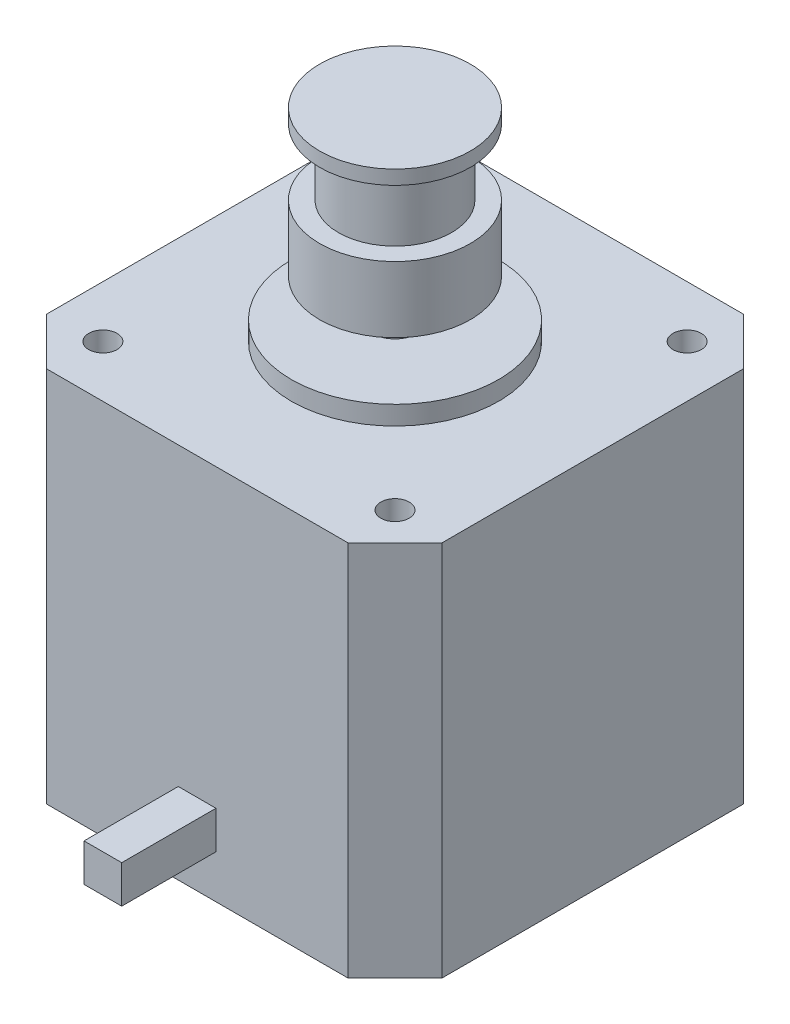
from build123d import *

# Parameters (mm, degrees)
SKETCH1_W           = 42
SKETCH1_H           = 42
BOSS_EXTRUDE1_DEPTH = 40
CHAMFER1_SIZE       = 5
SKETCH2_R           = 11
BOSS_EXTRUDE3_DEPTH = 2
SKETCH5_R           = 2.5
BOSS_EXTRUDE4_DEPTH = 4
SKETCH6_R           = 8
BOSS_EXTRUDE5_DEPTH = 7
SKETCH7_R           = 6
BOSS_EXTRUDE6_DEPTH = 7
SKETCH8_R           = 8
BOSS_EXTRUDE7_DEPTH = 1.5
SKETCH9_R           = 1.5
CUT_EXTRUDE1_DEPTH  = 4.5
SKETCH10_W          = 4
SKETCH10_H          = 4
BOSS_EXTRUDE8_DEPTH = 10


with BuildPart() as part:
    # Sketch1 → Boss-Extrude1 (new body)
    with BuildSketch(Plane(origin=(0, 0, 0), x_dir=(1, 0, 0), z_dir=(0, 1, 0))):
        Rectangle(SKETCH1_W, SKETCH1_H)
    extrude(amount=BOSS_EXTRUDE1_DEPTH)

    # Chamfer1
    chamfer1_edges = [part.edges().sort_by_distance(p)[0] for p in [
        (21, 20, 21),
        (-21, 20, 21),
        (-21, 20, -21),
        (21, 20, -21),
    ]]
    chamfer(chamfer1_edges, length=CHAMFER1_SIZE)

    # Sketch2 → Boss-Extrude3 (add)
    with BuildSketch(Plane(origin=(0, 40, 0), x_dir=(1, 0, 0), z_dir=(0, 1, 0))):
        with Locations(Location((0, 0, 0), (0, 0, 270))):
            Circle(SKETCH2_R)
    extrude(amount=BOSS_EXTRUDE3_DEPTH)

    # Sketch5 → Boss-Extrude4 (add)
    with BuildSketch(Plane(origin=(0, 42, 0), x_dir=(1, 0, 0), z_dir=(0, 1, 0))):
        with Locations(Location((0, 0, 0), (0, 0, 270))):
            Circle(SKETCH5_R)
    extrude(amount=BOSS_EXTRUDE4_DEPTH)

    # Sketch6 → Boss-Extrude5 (add)
    with BuildSketch(Plane(origin=(0, 46, 0), x_dir=(1, 0, 0), z_dir=(0, 1, 0))):
        with Locations(Location((0, 0, 0), (0, 0, 270))):
            Circle(SKETCH6_R)
    extrude(amount=BOSS_EXTRUDE5_DEPTH)

    # Sketch7 → Boss-Extrude6 (add)
    with BuildSketch(Plane(origin=(0, 53, 0), x_dir=(1, 0, 0), z_dir=(0, 1, 0))):
        with Locations(Location((0, 0, 0), (0, 0, 270))):
            Circle(SKETCH7_R)
    extrude(amount=BOSS_EXTRUDE6_DEPTH)

    # Sketch8 → Boss-Extrude7 (add)
    with BuildSketch(Plane(origin=(0, 60, 0), x_dir=(1, 0, 0), z_dir=(0, 1, 0))):
        with Locations(Location((0, 0, 0), (0, 0, 270))):
            Circle(SKETCH8_R)
    extrude(amount=BOSS_EXTRUDE7_DEPTH)

    # Sketch9 → Cut-Extrude1 (cut)
    with BuildSketch(Plane(origin=(0, 40, 0), x_dir=(1, 0, 0), z_dir=(0, 1, 0))):
        with Locations(Location((-15.5, 15.5, 0), (0, 0, 270))):
            Circle(SKETCH9_R)
        with Locations(Location((15.5, 15.5, 0), (0, 0, 270))):
            Circle(SKETCH9_R)
        with Locations(Location((15.5, -15.5, 0), (0, 0, 270))):
            Circle(SKETCH9_R)
        with Locations(Location((-15.5, -15.5, 0), (0, 0, 270))):
            Circle(SKETCH9_R)
    extrude(amount=-CUT_EXTRUDE1_DEPTH, mode=Mode.SUBTRACT)

    # Sketch10 → Boss-Extrude8 (add)
    with BuildSketch(Plane.XY.offset(21)):
        with Locations((0, 6.6)):
            Rectangle(SKETCH10_W, SKETCH10_H)
    extrude(amount=BOSS_EXTRUDE8_DEPTH)


solid = part.part
